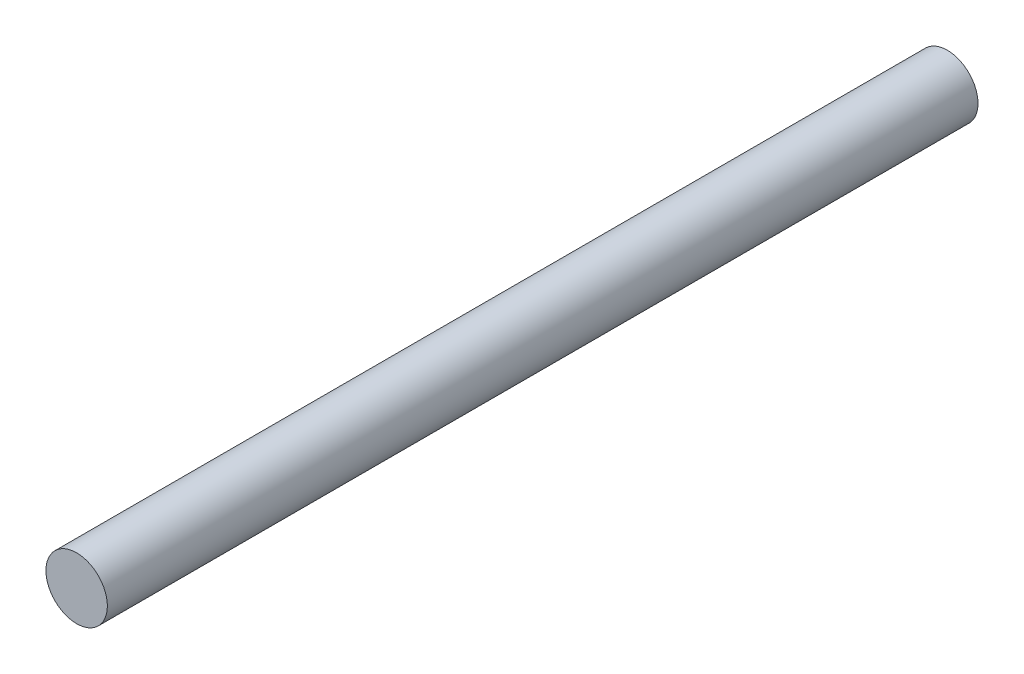
from build123d import *

# Parameters (mm, degrees)
SKETCH1_R      = 14.64
EXTRUDE1_DEPTH = 415


with BuildPart() as part:
    # Sketch1 → Extrude1 (new body)
    with BuildSketch(Plane.XY):
        Circle(SKETCH1_R)
    extrude(amount=EXTRUDE1_DEPTH)


solid = part.part
